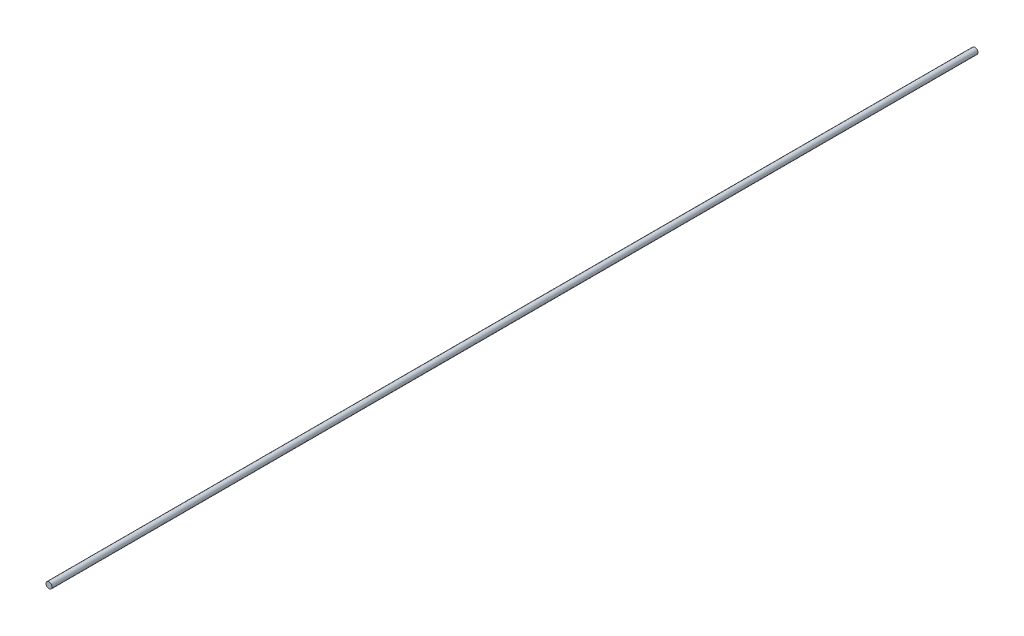
from build123d import *

# Parameters (mm, degrees)
SKETCH1_R           = 2
BOSS_EXTRUDE1_DEPTH = 610


with BuildPart() as part:
    # Sketch1 → Boss-Extrude1 (new body)
    with BuildSketch(Plane.XY):
        Circle(SKETCH1_R)
    extrude(amount=BOSS_EXTRUDE1_DEPTH)


solid = part.part
